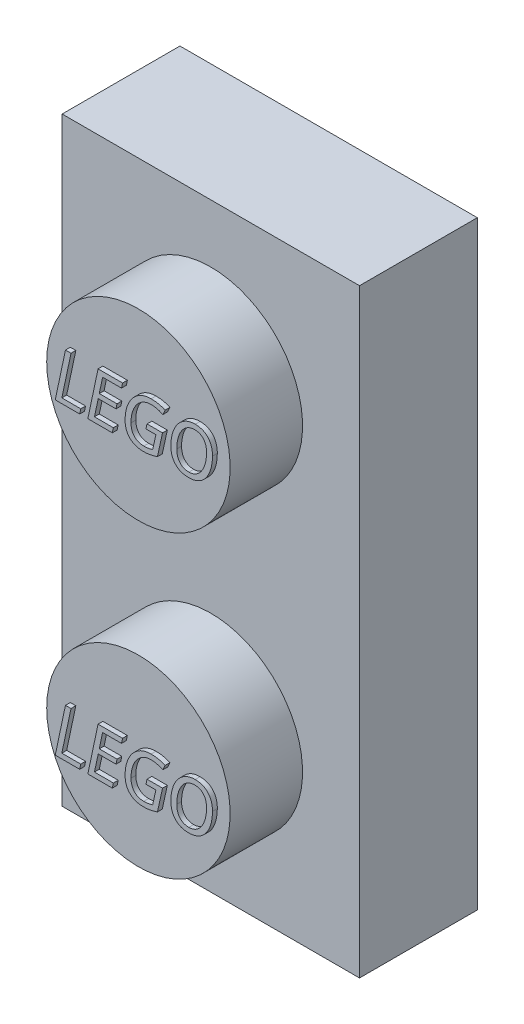
from build123d import *

# Parameters (mm, degrees)
SKETCH1_W           = 7.8232
SKETCH1_H           = 15.7734
BOSS_EXTRUDE1_DEPTH = 3.0988
SKETCH2_R           = 2.413
BOSS_EXTRUDE2_DEPTH = 1.905
BOSS_EXTRUDE3_DEPTH = 0.127
BOSS_EXTRUDE4_DEPTH = 0.127
SKETCH5_W           = 4.7752
SKETCH5_H           = 12.7254
CUT_EXTRUDE1_DEPTH  = 2.54
SKETCH6_R           = 1.27
CUT_EXTRUDE2_DEPTH  = 2.032
SKETCH7_R           = 1.4859
BOSS_EXTRUDE5_DEPTH = 2.54
SKETCH8_R           = 0.635
CUT_EXTRUDE3_DEPTH  = 2.54


with BuildPart() as part:
    # Sketch1 → Boss-Extrude1 (new body)
    with BuildSketch(Plane.XY):
        Rectangle(SKETCH1_W, SKETCH1_H)
    extrude(amount=BOSS_EXTRUDE1_DEPTH)

    # Sketch2 → Boss-Extrude2 (add)
    with BuildSketch(Plane.XY.offset(3.0988)):
        with Locations(Location((0, -3.94335, 0), (0, 0, 180))):
            Circle(SKETCH2_R)
        with Locations(Location((0, 3.94335, 0), (0, 0, 180))):
            Circle(SKETCH2_R)
    extrude(amount=BOSS_EXTRUDE2_DEPTH)

    # Sketch3 → Boss-Extrude3 (add)
    # profile 1 of 4: a face of its own
    with BuildSketch(Plane.XY.offset(5.0038)):
        Polygon((-2.06117289, 3.3147), (-1.792380276, 4.5847), (-1.646258117, 4.5847), (-1.887991071, 3.446905763), (-1.389577922, 3.446905763), (-1.417410714, 3.3147), align=None)
    # profile 2 of 4: a face of its own
    with BuildSketch(Plane.XY.offset(5.0038)):
        Polygon((-1.203510552, 3.3147), (-0.934717938, 4.5847), (-0.29018263, 4.5847), (-0.318015422, 4.454298214), (-0.815397727, 4.454298214), (-0.903277192, 4.037321753), (-0.437077922, 4.037321753), (-0.462333604, 3.908466234), (-0.929563718, 3.908466234), (-1.030328734, 3.445101786), (-0.531915584, 3.445101786), (-0.559748377, 3.3147), align=None)
    # profile 3 of 4: a face of its own
    with BuildSketch(Plane.XY.offset(5.0038)):
        with BuildLine():
            add(Edge.make_bspline(
                [(0.254360795, 3.298206494), (0.236046061, 3.298595298), (0.200433248, 3.299351326), (0.148542489, 3.30541857), (0.099713701, 3.315095562), (0.0538055, 3.328686708), (0.011115394, 3.346480371), (-0.02839823, 3.368356854), (-0.065007758, 3.39392474), (-0.098291415, 3.423617569), (-0.127851706, 3.45694904), (-0.153992886, 3.493229694), (-0.175596054, 3.532983601), (-0.193418089, 3.575740856), (-0.207394892, 3.621565749), (-0.217020941, 3.67061491), (-0.223040778, 3.722678563), (-0.223813242, 3.75846148), (-0.224208604, 3.776775893)],
                knots=[0, 0, 0, 0, 1.143595834, 2.223710346, 3.258027973, 4.249329772, 5.208878035, 6.140634738, 7.064978336, 7.99218253, 8.919386724, 9.842452636, 10.77890879, 11.738457054, 12.731311174, 13.7656288, 14.856404166, 16, 16, 16, 16], degree=3))
            add(Edge.make_bspline(
                [(-0.224208604, 3.776775893), (-0.223803893, 3.799896763), (-0.223006657, 3.845442296), (-0.216947426, 3.912759984), (-0.207010365, 3.978036502), (-0.192734474, 4.041174858), (-0.175020874, 4.102063739), (-0.153687674, 4.160407806), (-0.128542386, 4.215962253), (-0.100274407, 4.26882875), (-0.068683241, 4.318694491), (-0.03346547, 4.364717451), (0.00418825, 4.407693083), (0.045254686, 4.446451896), (0.088859334, 4.481783579), (0.135276843, 4.512582866), (0.184043673, 4.53949696), (0.235400669, 4.561452529), (0.288892649, 4.579565743), (0.344615106, 4.591991731), (0.402327157, 4.599722579), (0.441434263, 4.600697961), (0.46130276, 4.601193506)],
                knots=[0, 0, 0, 0, 1.158786562, 2.282680181, 3.384928086, 4.466117397, 5.524840755, 6.561514544, 7.577130093, 8.578877329, 9.564325196, 10.53229972, 11.480966204, 12.425136777, 13.359189339, 14.290687764, 15.213718436, 16.147175327, 17.086700215, 18.040395622, 19.004416393, 20, 20, 20, 20], degree=3))
            add(Edge.make_bspline(
                [(0.46130276, 4.601193506), (0.479690748, 4.600926218), (0.515472513, 4.600406093), (0.567469901, 4.596967134), (0.616071302, 4.590472242), (0.661645261, 4.5816237), (0.705015935, 4.570612215), (0.747184142, 4.55799339), (0.788330886, 4.543433645), (0.815022665, 4.532091929), (0.828283279, 4.526457305)],
                knots=[0, 0, 0, 0, 1.169382961, 2.275539035, 3.311607993, 4.2854943, 5.22621088, 6.156030547, 7.083906376, 8, 8, 8, 8], degree=3))
            Line((0.828283279, 4.526457305), (0.771844562, 4.397601786))
            add(Edge.make_bspline(
                [(0.771844562, 4.397601786), (0.748803881, 4.407453752), (0.701667554, 4.427608778), (0.63967738, 4.446688729), (0.587534917, 4.45930535), (0.546258731, 4.465822214), (0.503402605, 4.470157521), (0.474285299, 4.470578126), (0.459498782, 4.470791721)],
                knots=[0, 0, 0, 0, 1.394338297, 2.852519255, 3.60423063, 4.379474462, 5.17705547, 6, 6, 6, 6], degree=3))
            add(Edge.make_bspline(
                [(0.459498782, 4.470791721), (0.441074672, 4.470218653), (0.404759328, 4.469089092), (0.351261035, 4.459438773), (0.299827587, 4.443779708), (0.250658536, 4.421573147), (0.203991805, 4.39410171), (0.16042686, 4.360866031), (0.119454917, 4.322992581), (0.08221368, 4.279493688), (0.048463054, 4.231473718), (0.018432844, 4.179115106), (-0.007501558, 4.122472351), (-0.029689894, 4.061960098), (-0.047273109, 3.997676496), (-0.059411133, 3.929967279), (-0.067094736, 3.859162582), (-0.068059575, 3.810899856), (-0.068551136, 3.786311201)],
                knots=[0, 0, 0, 0, 0.918079208, 1.80960496, 2.701141003, 3.592707914, 4.493334812, 5.395417102, 6.319799705, 7.270368087, 8.244839726, 9.242596192, 10.275605708, 11.347481976, 12.453095309, 13.594014105, 14.774210205, 16, 16, 16, 16], degree=3))
            add(Edge.make_bspline(
                [(-0.068551136, 3.786311201), (-0.068137733, 3.769446571), (-0.067330407, 3.736512092), (-0.060101395, 3.688613093), (-0.048996672, 3.643375961), (-0.032686954, 3.601322205), (-0.01208088, 3.562550627), (0.014291222, 3.528542596), (0.044501762, 3.49814499), (0.080057393, 3.472770137), (0.120295951, 3.452085813), (0.165716784, 3.437948746), (0.215775548, 3.42892218), (0.250796256, 3.428038198), (0.269050325, 3.427577435)],
                knots=[0, 0, 0, 0, 1.085906117, 2.120636679, 3.113953251, 4.081115043, 5.019731959, 5.931851402, 6.843702151, 7.771454357, 8.734299291, 9.745948793, 10.825106439, 12, 12, 12, 12], degree=3))
            add(Edge.make_bspline(
                [(0.269050325, 3.427577435), (0.291667882, 3.428114067), (0.335333992, 3.429150104), (0.388466573, 3.436009976), (0.427725041, 3.443790982), (0.454436279, 3.44996634), (0.479034358, 3.456356298), (0.494562362, 3.461113965), (0.502021104, 3.463399269)],
                knots=[0, 0, 0, 0, 1.720252296, 3.321168789, 4.067094781, 4.764615085, 5.406593642, 6, 6, 6, 6], degree=3))
            Line((0.502021104, 3.463399269), (0.586550325, 3.84558474))
            Line((0.586550325, 3.84558474), (0.325489042, 3.84558474))
            Line((0.325489042, 3.84558474), (0.353321834, 3.97444026))
            Line((0.353321834, 3.97444026), (0.761278409, 3.97444026))
            Line((0.761278409, 3.97444026), (0.627268669, 3.364953653))
            add(Edge.make_bspline(
                [(0.627268669, 3.364953653), (0.599646265, 3.355613792), (0.543296888, 3.336560586), (0.470032645, 3.318864417), (0.408303783, 3.308273422), (0.359121981, 3.302290036), (0.307492876, 3.299056373), (0.272318813, 3.298493743), (0.254360795, 3.298206494)],
                knots=[0, 0, 0, 0, 1.377779224, 2.810653326, 3.556266806, 4.337384782, 5.151156514, 6, 6, 6, 6], degree=3))
        make_face()
    # profile 4 of 4: a face of its own
    with BuildSketch(Plane.XY.offset(5.0038)):
        with BuildLine():
            add(Edge.make_bspline(
                [(1.44859375, 3.298206494), (1.436045748, 3.29841044), (1.411518506, 3.298809088), (1.375477961, 3.301755614), (1.340935468, 3.306236446), (1.30789636, 3.312989791), (1.276322363, 3.321544401), (1.246146513, 3.331656704), (1.217664609, 3.344258233), (1.190589739, 3.358263505), (1.165290649, 3.374397639), (1.141490499, 3.39192707), (1.119281381, 3.411067286), (1.098586722, 3.431650409), (1.079749795, 3.453982247), (1.062334585, 3.477776192), (1.046774604, 3.503305257), (1.032433076, 3.530143071), (1.02017227, 3.558578234), (1.00942059, 3.588200993), (0.999911113, 3.618912183), (0.992995336, 3.651055042), (0.986843661, 3.68427258), (0.982934116, 3.718805481), (0.980161513, 3.754481351), (0.979933347, 3.778660038), (0.97981737, 3.79095)],
                knots=[0, 0, 0, 0, 1.168955858, 2.284926561, 3.367034092, 4.412408436, 5.423930988, 6.413558737, 7.374117372, 8.322798991, 9.250934043, 10.166561836, 11.074602588, 11.980100199, 12.882941088, 13.793834386, 14.724519548, 15.666118699, 16.626677334, 17.606547768, 18.601597821, 19.619024221, 20.667763349, 21.747856332, 22.85524141, 24, 24, 24, 24], degree=3))
            add(Edge.make_bspline(
                [(0.97981737, 3.79095), (0.980087369, 3.808823287), (0.980624016, 3.844348004), (0.984239325, 3.89716823), (0.990496819, 3.949094846), (0.998959632, 4.000100021), (1.009759309, 4.050078441), (1.022888884, 4.098859478), (1.038385335, 4.146218706), (1.055846768, 4.192221638), (1.07566841, 4.236432867), (1.097538244, 4.278857762), (1.121869149, 4.319201475), (1.148451451, 4.357523295), (1.176797302, 4.394038608), (1.208041283, 4.427327855), (1.240359465, 4.458932502), (1.27537733, 4.487093249), (1.311906289, 4.513127002), (1.350640806, 4.535679718), (1.391068067, 4.555468319), (1.433458092, 4.571978764), (1.477725145, 4.58519972), (1.523974135, 4.594372802), (1.571884508, 4.600259114), (1.604491404, 4.60087941), (1.621002435, 4.601193506)],
                knots=[0, 0, 0, 0, 1.116038485, 2.21822388, 3.304050474, 4.380776463, 5.445504046, 6.495564922, 7.533693371, 8.555789062, 9.566632916, 10.557467757, 11.534426497, 12.506039928, 13.468608809, 14.417600834, 15.354647701, 16.288742167, 17.220353708, 18.153199827, 19.084008015, 20.028319335, 20.990634104, 21.964761415, 22.969423902, 24, 24, 24, 24], degree=3))
            add(Edge.make_bspline(
                [(1.621002435, 4.601193506), (1.638374765, 4.600822145), (1.672204349, 4.600098982), (1.721465577, 4.593771305), (1.767845094, 4.583566454), (1.811381757, 4.569073784), (1.852168024, 4.550600039), (1.889662797, 4.527345075), (1.924518354, 4.500523716), (1.955923294, 4.469334348), (1.984402336, 4.434868073), (2.008928563, 4.396751071), (2.029554353, 4.355474563), (2.046704383, 4.311160811), (2.059707177, 4.263459213), (2.069193977, 4.212618108), (2.074947234, 4.158578543), (2.075552234, 4.12152175), (2.075862419, 4.102522646)],
                knots=[0, 0, 0, 0, 1.089030849, 2.120697689, 3.108756826, 4.062730778, 4.993189163, 5.909710898, 6.823473787, 7.745331065, 8.679260537, 9.622127337, 10.580971283, 11.568384053, 12.596966134, 13.676764453, 14.808871795, 16, 16, 16, 16], degree=3))
            add(Edge.make_bspline(
                [(2.075862419, 4.102522646), (2.075691021, 4.08516399), (2.075349597, 4.050585654), (2.071774927, 3.99900908), (2.06653187, 3.947994737), (2.058686444, 3.897716679), (2.049006859, 3.848424246), (2.037147911, 3.800232399), (2.022919388, 3.753395968), (2.006797966, 3.707726016), (1.988275419, 3.663763813), (1.967560233, 3.621504171), (1.944706524, 3.581115403), (1.919623945, 3.542675873), (1.892798161, 3.506204458), (1.863127465, 3.47269034), (1.831720815, 3.441307133), (1.797908834, 3.412732781), (1.76201513, 3.386768425), (1.723761198, 3.364091183), (1.683292107, 3.344475427), (1.640837126, 3.327595256), (1.595972168, 3.31445317), (1.548915881, 3.304924997), (1.499508112, 3.299136309), (1.465790331, 3.298520543), (1.44859375, 3.298206494)],
                knots=[0, 0, 0, 0, 1.093442335, 2.178130483, 3.255720589, 4.323480706, 5.38274449, 6.419707839, 7.448689248, 8.465486664, 9.469631499, 10.452311849, 11.429027763, 12.391241676, 13.342680315, 14.278443439, 15.208382174, 16.137643483, 17.06436399, 17.996237756, 18.935375262, 19.895150872, 20.871266837, 21.876402931, 22.916933251, 24, 24, 24, 24], degree=3))
        make_face()
        with BuildLine():
            add(Edge.make_bspline(
                [(1.454005682, 3.427577435), (1.466221985, 3.427841726), (1.490326639, 3.428363213), (1.525691367, 3.433476267), (1.55974385, 3.441372576), (1.5923485, 3.452819325), (1.623364175, 3.46730211), (1.653115428, 3.484140113), (1.681108245, 3.503801051), (1.707829337, 3.525846249), (1.733011568, 3.550225689), (1.756372273, 3.577017988), (1.778824601, 3.605290371), (1.798965984, 3.636156999), (1.81795999, 3.668496858), (1.835714535, 3.702347688), (1.851146034, 3.73800266), (1.865823552, 3.774827307), (1.878243982, 3.813211216), (1.889346172, 3.852666857), (1.898958592, 3.893138898), (1.909108968, 3.948629568), (1.918479842, 4.019581399), (1.919627219, 4.076974228), (1.920204951, 4.10587289)],
                knots=[0, 0, 0, 0, 0.882596435, 1.741499137, 2.577466932, 3.406253735, 4.234225869, 5.049147165, 5.874320038, 6.70361851, 7.551199594, 8.404697506, 9.271777652, 10.158776091, 11.066190695, 11.982759909, 12.919718314, 13.873402155, 14.847430715, 15.834359835, 16.836027003, 17.853034061, 19.911903442, 22, 22, 22, 22], degree=3))
            add(Edge.make_bspline(
                [(1.920204951, 4.10587289), (1.919970005, 4.119884347), (1.91951214, 4.147190016), (1.915607323, 4.186900844), (1.909220373, 4.224217133), (1.900246878, 4.259162424), (1.888632914, 4.291655162), (1.874757211, 4.321928829), (1.857855738, 4.34958585), (1.838620468, 4.374925029), (1.816838642, 4.3973113), (1.793346301, 4.417184418), (1.767588378, 4.433641109), (1.740113099, 4.447504041), (1.710498081, 4.458062752), (1.67886506, 4.465502542), (1.645264065, 4.469881417), (1.622218077, 4.470483777), (1.610436282, 4.470791721)],
                knots=[0, 0, 0, 0, 1.239860654, 2.416252998, 3.527451984, 4.587781495, 5.605012743, 6.577831451, 7.529686828, 8.467932867, 9.387384701, 10.288805072, 11.185080675, 12.086116208, 13.007201173, 13.960603863, 14.957400013, 16, 16, 16, 16], degree=3))
            add(Edge.make_bspline(
                [(1.610436282, 4.470791721), (1.598223649, 4.470498518), (1.574052535, 4.469918214), (1.538498809, 4.465190547), (1.504174338, 4.457410145), (1.471195723, 4.446642816), (1.439731717, 4.43273153), (1.409251723, 4.416964307), (1.380783969, 4.397558094), (1.353351312, 4.37635963), (1.327895762, 4.352336987), (1.303463549, 4.326701924), (1.281178297, 4.298326945), (1.259958757, 4.268350367), (1.240815709, 4.23618575), (1.22256354, 4.202739575), (1.206406607, 4.167273805), (1.191821489, 4.13024662), (1.178586802, 4.091853093), (1.167390561, 4.052138048), (1.157514169, 4.011421075), (1.149524412, 3.969620175), (1.143499347, 3.926943344), (1.138649388, 3.883476431), (1.136208721, 3.839169959), (1.135720756, 3.809335703), (1.135474838, 3.794300244)],
                knots=[0, 0, 0, 0, 0.956300612, 1.892700035, 2.803512342, 3.70993997, 4.60493266, 5.495869393, 6.393488626, 7.299341688, 8.208686487, 9.132135858, 10.070515445, 11.031844718, 12.006921323, 13.000373568, 14.01497362, 15.057023746, 16.116672912, 17.19432696, 18.287745679, 19.397541574, 20.526087023, 21.662945993, 22.822203617, 24, 24, 24, 24], degree=3))
            add(Edge.make_bspline(
                [(1.135474838, 3.794300244), (1.135893941, 3.775895133), (1.136704055, 3.740318574), (1.143660368, 3.688882262), (1.155519981, 3.64155025), (1.171609954, 3.598131614), (1.192557485, 3.559149337), (1.217943233, 3.524888628), (1.247465644, 3.495238575), (1.281250573, 3.470577677), (1.319137567, 3.451103401), (1.360912549, 3.437547897), (1.406247804, 3.429100793), (1.437731021, 3.428096556), (1.454005682, 3.427577435)],
                knots=[0, 0, 0, 0, 1.203410972, 2.326159335, 3.386320658, 4.389146959, 5.346940135, 6.270624126, 7.16848677, 8.073126889, 8.995323065, 9.942310976, 10.936316116, 12, 12, 12, 12], degree=3))
        make_face(mode=Mode.SUBTRACT)
    extrude(amount=BOSS_EXTRUDE3_DEPTH)

    # Sketch4 → Boss-Extrude4 (add)
    # profile 1 of 4: a face of its own
    with BuildSketch(Plane.XY.offset(5.0038)):
        Polygon((-2.06117289, -4.779918013), (-1.792380276, -3.509918013), (-1.646258117, -3.509918013), (-1.887991071, -4.64771225), (-1.389577922, -4.64771225), (-1.417410714, -4.779918013), align=None)
    # profile 2 of 4: a face of its own
    with BuildSketch(Plane.XY.offset(5.0038)):
        Polygon((-1.203510552, -4.779918013), (-0.934717938, -3.509918013), (-0.29018263, -3.509918013), (-0.318015422, -3.640319799), (-0.815397727, -3.640319799), (-0.903277192, -4.05729626), (-0.437077922, -4.05729626), (-0.462333604, -4.186151779), (-0.929563718, -4.186151779), (-1.030328734, -4.649516227), (-0.531915584, -4.649516227), (-0.559748377, -4.779918013), align=None)
    # profile 3 of 4: a face of its own
    with BuildSketch(Plane.XY.offset(5.0038)):
        with BuildLine():
            add(Edge.make_bspline(
                [(0.254360795, -4.79641152), (0.236046061, -4.796022715), (0.200433248, -4.795266687), (0.148542489, -4.789199443), (0.099713701, -4.779522451), (0.0538055, -4.765931305), (0.011115394, -4.748137642), (-0.02839823, -4.726261159), (-0.065007758, -4.700693273), (-0.098291415, -4.671000444), (-0.127851706, -4.637668973), (-0.153992886, -4.601388319), (-0.175596054, -4.561634412), (-0.193418089, -4.518877157), (-0.207394892, -4.473052264), (-0.217020941, -4.424003103), (-0.223040778, -4.37193945), (-0.223813242, -4.336156533), (-0.224208604, -4.31784212)],
                knots=[0, 0, 0, 0, 1.143595834, 2.223710346, 3.258027973, 4.249329772, 5.208878035, 6.140634738, 7.064978336, 7.99218253, 8.919386724, 9.842452636, 10.77890879, 11.738457054, 12.731311174, 13.7656288, 14.856404166, 16, 16, 16, 16], degree=3))
            add(Edge.make_bspline(
                [(-0.224208604, -4.31784212), (-0.223803893, -4.29472125), (-0.223006657, -4.249175718), (-0.216947426, -4.181858029), (-0.207010365, -4.116581511), (-0.192734474, -4.053443155), (-0.175020874, -3.992554274), (-0.153687674, -3.934210207), (-0.128542386, -3.87865576), (-0.100274407, -3.825789263), (-0.068683241, -3.775923522), (-0.03346547, -3.729900562), (0.00418825, -3.68692493), (0.045254686, -3.648166117), (0.088859334, -3.612834434), (0.135276843, -3.582035147), (0.184043673, -3.555121053), (0.235400669, -3.533165484), (0.288892649, -3.51505227), (0.344615106, -3.502626282), (0.402327157, -3.494895434), (0.441434263, -3.493920052), (0.46130276, -3.493424507)],
                knots=[0, 0, 0, 0, 1.158786562, 2.282680181, 3.384928086, 4.466117397, 5.524840755, 6.561514544, 7.577130093, 8.578877329, 9.564325196, 10.53229972, 11.480966204, 12.425136777, 13.359189339, 14.290687764, 15.213718436, 16.147175327, 17.086700215, 18.040395622, 19.004416393, 20, 20, 20, 20], degree=3))
            add(Edge.make_bspline(
                [(0.46130276, -3.493424507), (0.479690748, -3.493691795), (0.515472513, -3.49421192), (0.567469901, -3.497650879), (0.616071302, -3.504145771), (0.661645261, -3.512994313), (0.705015935, -3.524005798), (0.747184142, -3.536624623), (0.788330886, -3.551184368), (0.815022665, -3.562526084), (0.828283279, -3.568160708)],
                knots=[0, 0, 0, 0, 1.169382961, 2.275539035, 3.311607993, 4.2854943, 5.22621088, 6.156030547, 7.083906376, 8, 8, 8, 8], degree=3))
            Line((0.828283279, -3.568160708), (0.771844562, -3.697016227))
            add(Edge.make_bspline(
                [(0.771844562, -3.697016227), (0.748803881, -3.687164261), (0.701667554, -3.667009235), (0.63967738, -3.647929284), (0.587534917, -3.635312663), (0.546258731, -3.628795799), (0.503402605, -3.624460492), (0.474285299, -3.624039887), (0.459498782, -3.623826292)],
                knots=[0, 0, 0, 0, 1.394338297, 2.852519255, 3.60423063, 4.379474462, 5.17705547, 6, 6, 6, 6], degree=3))
            add(Edge.make_bspline(
                [(0.459498782, -3.623826292), (0.441074672, -3.62439936), (0.404759328, -3.625528921), (0.351261035, -3.63517924), (0.299827587, -3.650838305), (0.250658536, -3.673044866), (0.203991805, -3.700516303), (0.16042686, -3.733751982), (0.119454917, -3.771625432), (0.08221368, -3.815124325), (0.048463054, -3.863144295), (0.018432844, -3.915502907), (-0.007501558, -3.972145662), (-0.029689894, -4.032657915), (-0.047273109, -4.096941517), (-0.059411133, -4.164650734), (-0.067094736, -4.235455431), (-0.068059575, -4.283718157), (-0.068551136, -4.308306812)],
                knots=[0, 0, 0, 0, 0.918079208, 1.80960496, 2.701141003, 3.592707914, 4.493334812, 5.395417102, 6.319799705, 7.270368087, 8.244839726, 9.242596192, 10.275605708, 11.347481976, 12.453095309, 13.594014105, 14.774210205, 16, 16, 16, 16], degree=3))
            add(Edge.make_bspline(
                [(-0.068551136, -4.308306812), (-0.068137733, -4.325171442), (-0.067330407, -4.358105921), (-0.060101395, -4.40600492), (-0.048996672, -4.451242052), (-0.032686954, -4.493295808), (-0.01208088, -4.532067386), (0.014291222, -4.566075417), (0.044501762, -4.596473023), (0.080057393, -4.621847877), (0.120295951, -4.642532201), (0.165716784, -4.656669267), (0.215775548, -4.665695833), (0.250796256, -4.666579815), (0.269050325, -4.667040578)],
                knots=[0, 0, 0, 0, 1.085906117, 2.120636679, 3.113953251, 4.081115043, 5.019731959, 5.931851402, 6.843702151, 7.771454357, 8.734299291, 9.745948793, 10.825106439, 12, 12, 12, 12], degree=3))
            add(Edge.make_bspline(
                [(0.269050325, -4.667040578), (0.291667882, -4.666503946), (0.335333992, -4.665467909), (0.388466573, -4.658608037), (0.427725041, -4.650827031), (0.454436279, -4.644651673), (0.479034358, -4.638261715), (0.494562362, -4.633504048), (0.502021104, -4.631218744)],
                knots=[0, 0, 0, 0, 1.720252296, 3.321168789, 4.067094781, 4.764615085, 5.406593642, 6, 6, 6, 6], degree=3))
            Line((0.502021104, -4.631218744), (0.586550325, -4.249033273))
            Line((0.586550325, -4.249033273), (0.325489042, -4.249033273))
            Line((0.325489042, -4.249033273), (0.353321834, -4.120177753))
            Line((0.353321834, -4.120177753), (0.761278409, -4.120177753))
            Line((0.761278409, -4.120177753), (0.627268669, -4.72966436))
            add(Edge.make_bspline(
                [(0.627268669, -4.72966436), (0.599646265, -4.739004221), (0.543296888, -4.758057427), (0.470032645, -4.775753596), (0.408303783, -4.786344591), (0.359121981, -4.792327977), (0.307492876, -4.79556164), (0.272318813, -4.79612427), (0.254360795, -4.79641152)],
                knots=[0, 0, 0, 0, 1.377779224, 2.810653326, 3.556266806, 4.337384782, 5.151156514, 6, 6, 6, 6], degree=3))
        make_face()
    # profile 4 of 4: a face of its own
    with BuildSketch(Plane.XY.offset(5.0038)):
        with BuildLine():
            add(Edge.make_bspline(
                [(1.44859375, -4.79641152), (1.436045748, -4.796207573), (1.411518506, -4.795808925), (1.375477961, -4.792862399), (1.340935468, -4.788381567), (1.30789636, -4.781628222), (1.276322363, -4.773073612), (1.246146513, -4.762961309), (1.217664609, -4.75035978), (1.190589739, -4.736354508), (1.165290649, -4.720220374), (1.141490499, -4.702690943), (1.119281381, -4.683550727), (1.098586722, -4.662967604), (1.079749795, -4.640635766), (1.062334585, -4.616841821), (1.046774604, -4.591312756), (1.032433076, -4.564474942), (1.02017227, -4.536039779), (1.00942059, -4.50641702), (0.999911113, -4.47570583), (0.992995336, -4.443562971), (0.986843661, -4.410345433), (0.982934116, -4.375812532), (0.980161513, -4.340136662), (0.979933347, -4.315957975), (0.97981737, -4.303668013)],
                knots=[0, 0, 0, 0, 1.168955858, 2.284926561, 3.367034092, 4.412408436, 5.423930988, 6.413558737, 7.374117372, 8.322798991, 9.250934043, 10.166561836, 11.074602588, 11.980100199, 12.882941088, 13.793834386, 14.724519548, 15.666118699, 16.626677334, 17.606547768, 18.601597821, 19.619024221, 20.667763349, 21.747856332, 22.85524141, 24, 24, 24, 24], degree=3))
            add(Edge.make_bspline(
                [(0.97981737, -4.303668013), (0.980087369, -4.285794726), (0.980624016, -4.250270009), (0.984239325, -4.197449783), (0.990496819, -4.145523167), (0.998959632, -4.094517992), (1.009759309, -4.044539572), (1.022888884, -3.995758535), (1.038385335, -3.948399307), (1.055846768, -3.902396375), (1.07566841, -3.858185146), (1.097538244, -3.815760251), (1.121869149, -3.775416538), (1.148451451, -3.737094718), (1.176797302, -3.700579405), (1.208041283, -3.667290158), (1.240359465, -3.635685511), (1.27537733, -3.607524764), (1.311906289, -3.581491011), (1.350640806, -3.558938295), (1.391068067, -3.539149694), (1.433458092, -3.522639249), (1.477725145, -3.509418293), (1.523974135, -3.500245211), (1.571884508, -3.494358899), (1.604491404, -3.493738603), (1.621002435, -3.493424507)],
                knots=[0, 0, 0, 0, 1.116038485, 2.21822388, 3.304050474, 4.380776463, 5.445504046, 6.495564922, 7.533693371, 8.555789062, 9.566632916, 10.557467757, 11.534426497, 12.506039928, 13.468608809, 14.417600834, 15.354647701, 16.288742167, 17.220353708, 18.153199827, 19.084008015, 20.028319335, 20.990634104, 21.964761415, 22.969423902, 24, 24, 24, 24], degree=3))
            add(Edge.make_bspline(
                [(1.621002435, -3.493424507), (1.638374765, -3.493795868), (1.672204349, -3.494519031), (1.721465577, -3.500846708), (1.767845094, -3.511051559), (1.811381757, -3.525544229), (1.852168024, -3.544017974), (1.889662797, -3.567272938), (1.924518354, -3.594094297), (1.955923294, -3.625283665), (1.984402336, -3.65974994), (2.008928563, -3.697866942), (2.029554353, -3.73914345), (2.046704383, -3.783457202), (2.059707177, -3.8311588), (2.069193977, -3.881999905), (2.074947234, -3.93603947), (2.075552234, -3.973096264), (2.075862419, -3.992095367)],
                knots=[0, 0, 0, 0, 1.089030849, 2.120697689, 3.108756826, 4.062730778, 4.993189163, 5.909710898, 6.823473787, 7.745331065, 8.679260537, 9.622127337, 10.580971283, 11.568384053, 12.596966134, 13.676764453, 14.808871795, 16, 16, 16, 16], degree=3))
            add(Edge.make_bspline(
                [(2.075862419, -3.992095367), (2.075691021, -4.009454023), (2.075349597, -4.044032359), (2.071774927, -4.095608933), (2.06653187, -4.146623276), (2.058686444, -4.196901334), (2.049006859, -4.246193767), (2.037147911, -4.294385614), (2.022919388, -4.341222045), (2.006797966, -4.386891997), (1.988275419, -4.4308542), (1.967560233, -4.473113842), (1.944706524, -4.51350261), (1.919623945, -4.55194214), (1.892798161, -4.588413555), (1.863127465, -4.621927673), (1.831720815, -4.65331088), (1.797908834, -4.681885232), (1.76201513, -4.707849588), (1.723761198, -4.73052683), (1.683292107, -4.750142586), (1.640837126, -4.767022757), (1.595972168, -4.780164843), (1.548915881, -4.789693016), (1.499508112, -4.795481704), (1.465790331, -4.79609747), (1.44859375, -4.79641152)],
                knots=[0, 0, 0, 0, 1.093442335, 2.178130483, 3.255720589, 4.323480706, 5.38274449, 6.419707839, 7.448689248, 8.465486664, 9.469631499, 10.452311849, 11.429027763, 12.391241676, 13.342680315, 14.278443439, 15.208382174, 16.137643483, 17.06436399, 17.996237756, 18.935375262, 19.895150872, 20.871266837, 21.876402931, 22.916933251, 24, 24, 24, 24], degree=3))
        make_face()
        with BuildLine():
            add(Edge.make_bspline(
                [(1.454005682, -4.667040578), (1.466221985, -4.666776287), (1.490326639, -4.6662548), (1.525691367, -4.661141746), (1.55974385, -4.653245437), (1.5923485, -4.641798688), (1.623364175, -4.627315903), (1.653115428, -4.6104779), (1.681108245, -4.590816962), (1.707829337, -4.568771764), (1.733011568, -4.544392324), (1.756372273, -4.517600025), (1.778824601, -4.489327642), (1.798965984, -4.458461014), (1.81795999, -4.426121155), (1.835714535, -4.392270325), (1.851146034, -4.356615353), (1.865823552, -4.319790706), (1.878243982, -4.281406797), (1.889346172, -4.241951156), (1.898958592, -4.201479115), (1.909108968, -4.145988445), (1.918479842, -4.075036614), (1.919627219, -4.017643785), (1.920204951, -3.988745123)],
                knots=[0, 0, 0, 0, 0.882596435, 1.741499137, 2.577466932, 3.406253735, 4.234225869, 5.049147165, 5.874320038, 6.70361851, 7.551199594, 8.404697506, 9.271777652, 10.158776091, 11.066190695, 11.982759909, 12.919718314, 13.873402155, 14.847430715, 15.834359835, 16.836027003, 17.853034061, 19.911903442, 22, 22, 22, 22], degree=3))
            add(Edge.make_bspline(
                [(1.920204951, -3.988745123), (1.919970005, -3.974733667), (1.91951214, -3.947427997), (1.915607323, -3.907717169), (1.909220373, -3.87040088), (1.900246878, -3.835455589), (1.888632914, -3.802962851), (1.874757211, -3.772689184), (1.857855738, -3.745032163), (1.838620468, -3.719692984), (1.816838642, -3.697306713), (1.793346301, -3.677433595), (1.767588378, -3.660976904), (1.740113099, -3.647113972), (1.710498081, -3.636555261), (1.67886506, -3.629115471), (1.645264065, -3.624736596), (1.622218077, -3.624134236), (1.610436282, -3.623826292)],
                knots=[0, 0, 0, 0, 1.239860654, 2.416252998, 3.527451984, 4.587781495, 5.605012743, 6.577831451, 7.529686828, 8.467932867, 9.387384701, 10.288805072, 11.185080675, 12.086116208, 13.007201173, 13.960603863, 14.957400013, 16, 16, 16, 16], degree=3))
            add(Edge.make_bspline(
                [(1.610436282, -3.623826292), (1.598223649, -3.624119495), (1.574052535, -3.624699799), (1.538498809, -3.629427466), (1.504174338, -3.637207868), (1.471195723, -3.647975197), (1.439731717, -3.661886483), (1.409251723, -3.677653707), (1.380783969, -3.697059919), (1.353351312, -3.718258383), (1.327895762, -3.742281026), (1.303463549, -3.767916089), (1.281178297, -3.796291068), (1.259958757, -3.826267646), (1.240815709, -3.858432263), (1.22256354, -3.891878438), (1.206406607, -3.927344208), (1.191821489, -3.964371393), (1.178586802, -4.00276492), (1.167390561, -4.042479965), (1.157514169, -4.083196938), (1.149524412, -4.124997839), (1.143499347, -4.167674669), (1.138649388, -4.211141582), (1.136208721, -4.255448054), (1.135720756, -4.28528231), (1.135474838, -4.30031777)],
                knots=[0, 0, 0, 0, 0.956300612, 1.892700035, 2.803512342, 3.70993997, 4.60493266, 5.495869393, 6.393488626, 7.299341688, 8.208686487, 9.132135858, 10.070515445, 11.031844718, 12.006921323, 13.000373568, 14.01497362, 15.057023746, 16.116672912, 17.19432696, 18.287745679, 19.397541574, 20.526087023, 21.662945993, 22.822203617, 24, 24, 24, 24], degree=3))
            add(Edge.make_bspline(
                [(1.135474838, -4.30031777), (1.135893941, -4.31872288), (1.136704055, -4.354299439), (1.143660368, -4.405735751), (1.155519981, -4.453067763), (1.171609954, -4.496486399), (1.192557485, -4.535468676), (1.217943233, -4.569729385), (1.247465644, -4.599379438), (1.281250573, -4.624040336), (1.319137567, -4.643514612), (1.360912549, -4.657070116), (1.406247804, -4.66551722), (1.437731021, -4.666521457), (1.454005682, -4.667040578)],
                knots=[0, 0, 0, 0, 1.203410972, 2.326159335, 3.386320658, 4.389146959, 5.346940135, 6.270624126, 7.16848677, 8.073126889, 8.995323065, 9.942310976, 10.936316116, 12, 12, 12, 12], degree=3))
        make_face(mode=Mode.SUBTRACT)
    extrude(amount=BOSS_EXTRUDE4_DEPTH)

    # Sketch5 → Cut-Extrude1 (cut)
    with BuildSketch(Plane(origin=(0, 0, 0), x_dir=(-1, 0, 0), z_dir=(0, 0, -1))):
        Rectangle(SKETCH5_W, SKETCH5_H)
    extrude(amount=-CUT_EXTRUDE1_DEPTH, mode=Mode.SUBTRACT)

    # Sketch6 → Cut-Extrude2 (cut)
    with BuildSketch(Plane(origin=(0, 0, 2.54), x_dir=(-1, 0, 0), z_dir=(0, 0, -1))):
        with Locations((0, 3.18135)):
            Circle(SKETCH6_R)
        with Locations(Location((0, -3.18135, 0), (0, 0, 180))):
            Circle(SKETCH6_R)
    extrude(amount=-CUT_EXTRUDE2_DEPTH, mode=Mode.SUBTRACT)

    # Sketch7 → Boss-Extrude5 (add)
    with BuildSketch(Plane(origin=(0, 0, 2.54), x_dir=(-1, 0, 0), z_dir=(0, 0, -1))):
        with Locations(Location((0, 0, 0), (0, 0, 180))):
            Circle(SKETCH7_R)
    extrude(amount=BOSS_EXTRUDE5_DEPTH)

    # Sketch8 → Cut-Extrude3 (cut)
    with BuildSketch(Plane(origin=(0, 0, 0), x_dir=(-1, 0, 0), z_dir=(0, 0, -1))):
        Circle(SKETCH8_R)
    extrude(amount=-CUT_EXTRUDE3_DEPTH, mode=Mode.SUBTRACT)


solid = part.part
